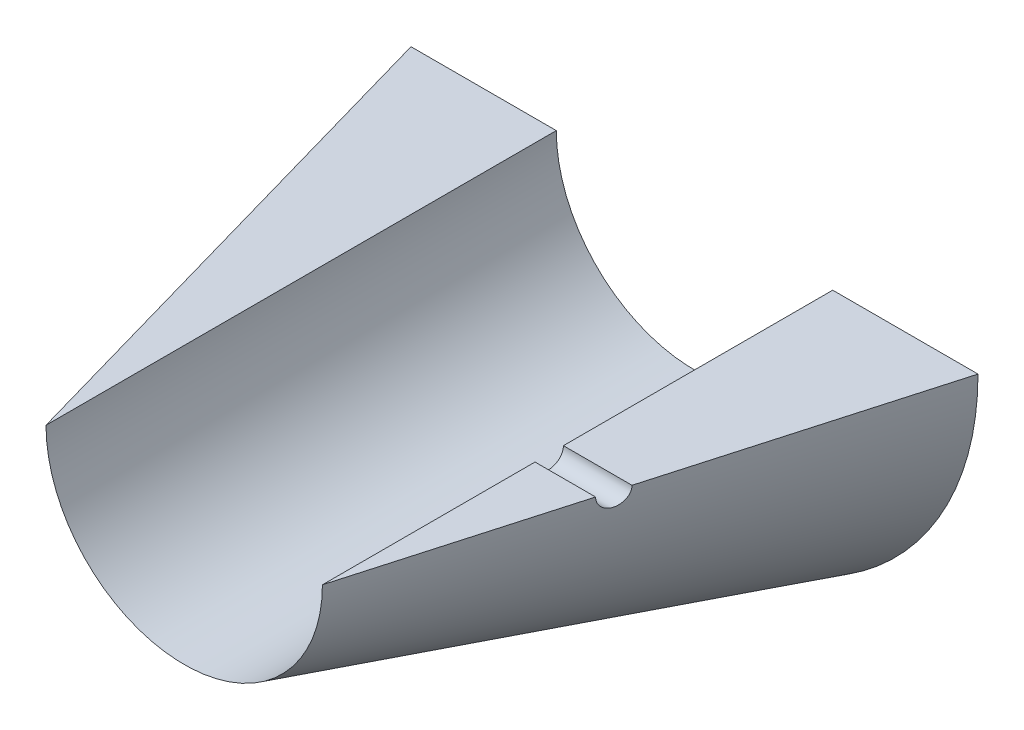
from build123d import *

# Parameters (mm, degrees)
ENL_V_MAT_EXTRU_1_REACH = 230.91
ESQUISSE7_R             = 5


with BuildPart() as part:
    # Esquisse4 → Révolution1 (revolve)
    with BuildSketch(Plane(origin=(0, 0, 0), x_dir=(0, 0, -1), z_dir=(1, 0, 0)), mode=Mode.PRIVATE) as r_volution1_sk:
        Polygon((-180, 48.75), (0, 100), (0, 48.75), align=None)
    revolve(r_volution1_sk.sketch.rotate(Axis((0, 0, 180), (0, 0, -1)), 90), axis=Axis((0, 0, 180), (0, 0, -1)))

    # Enlèv. mat.-Extru.1: up to this cone (the profile starts inside it)
    enl_v_mat_extru_1_end = Plane(origin=(0, 0, 100), z_dir=(0, 0, -1)).offset(-251.219511195) * Cone(1e-06, 157.780895062, 554.157288973, align=(Align.CENTER, Align.CENTER, Align.MIN), mode=Mode.PRIVATE)
    # Esquisse7 → Enlèv. mat.-Extru.1 (cut, up to the surface)
    with BuildSketch(Plane(origin=(0, 0, 0), x_dir=(0, 0, -1), z_dir=(1, 0, 0)), mode=Mode.PRIVATE) as enl_v_mat_extru_1_sk1:
        with Locations(Location((-100, 0, 0), (0, 0, 180))):
            Circle(ESQUISSE7_R)
    enl_v_mat_extru_1_tool1 = extrude(enl_v_mat_extru_1_sk1.sketch, amount=ENL_V_MAT_EXTRU_1_REACH, mode=Mode.PRIVATE) & enl_v_mat_extru_1_end
    add(enl_v_mat_extru_1_tool1.solids().sort_by_distance((0, 0, 100))[0], mode=Mode.SUBTRACT)

    # Enlèv. mat.-Surface1
    split(bisect_by=Plane(origin=(0, 0, 0), x_dir=(1, 0, 0), z_dir=(0, 1, 0)), keep=Keep.BOTTOM)


solid = part.part
